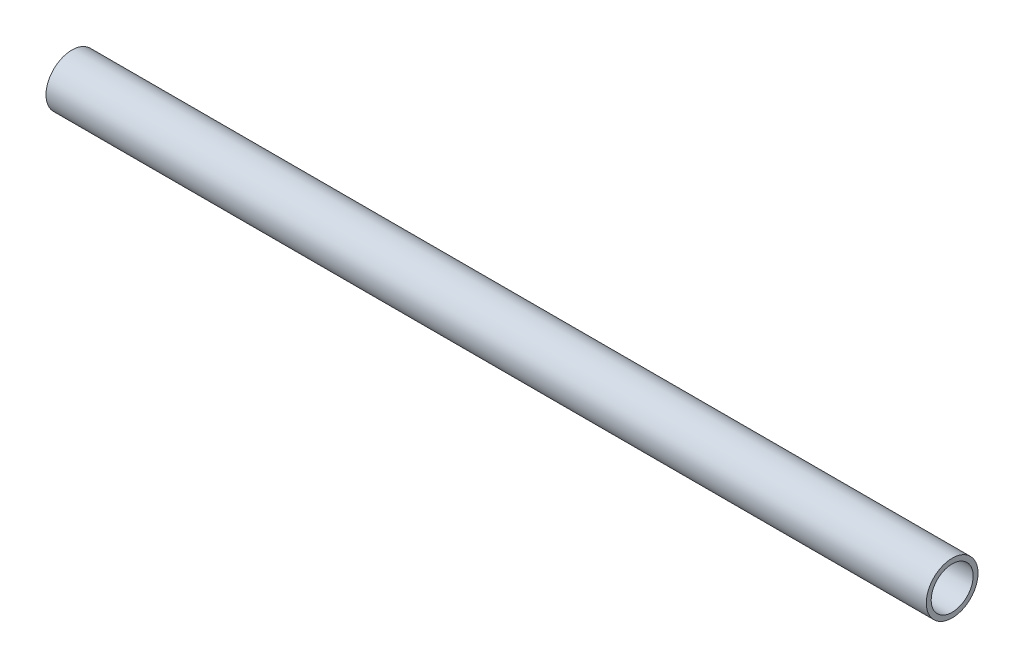
from build123d import *

# Parameters (mm, degrees)
SKETCH113_R                                    = 12.7
SKETCH113_R_2                                  = 10.287
AL_ROUND_TUBING_AL_RND_TUBE_1_OD_X_0_095_DEPTH = 431.8


with BuildPart() as part:
    # Sketch113 → Al round tubing AL RND TUBE 1 OD X 0.095 WALL(1) (new body)
    with BuildSketch(Plane(origin=(348.95660066, 0, -5.61650165), x_dir=(0, 0, 1), z_dir=(-1, 0, 0))):
        Circle(SKETCH113_R)
        Circle(SKETCH113_R_2, mode=Mode.SUBTRACT)
    extrude(amount=AL_ROUND_TUBING_AL_RND_TUBE_1_OD_X_0_095_DEPTH)


solid = part.part
